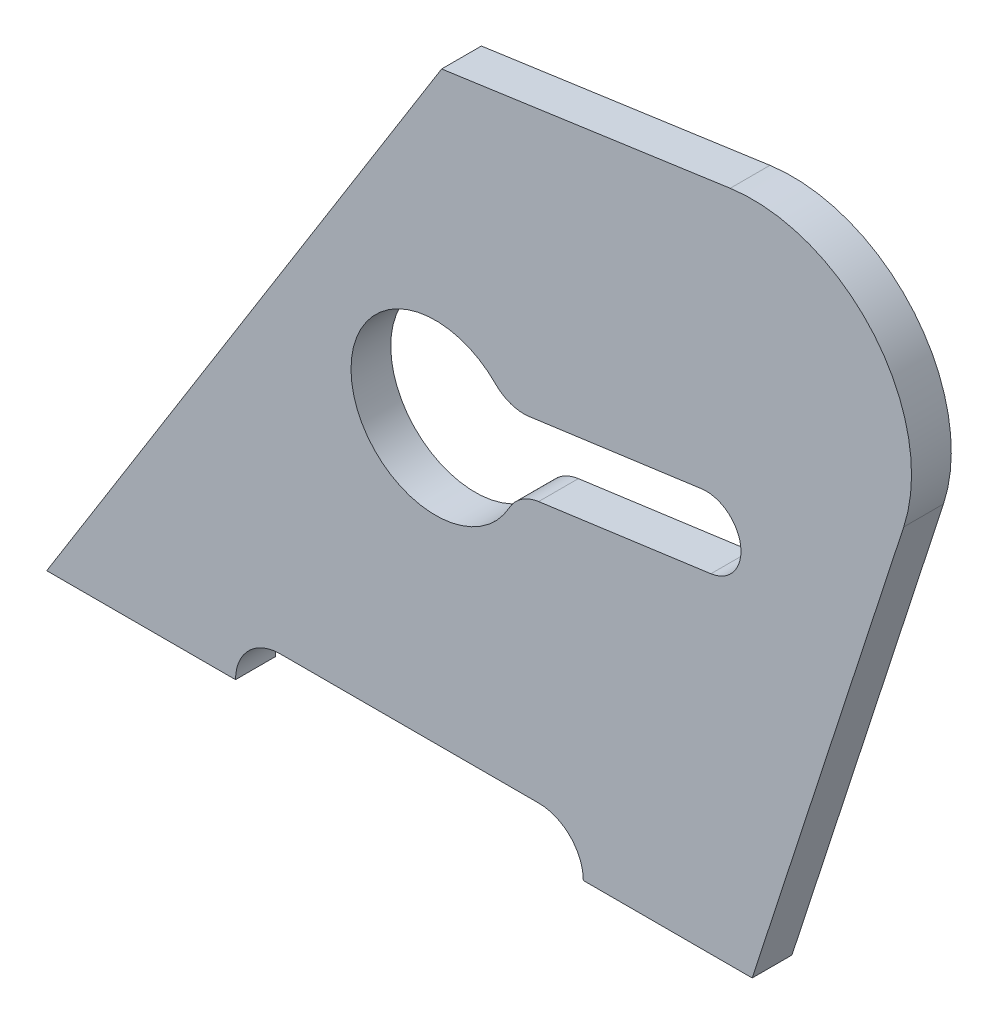
from build123d import *

# Parameters (mm, degrees)
DODANIE_WYCI_GNI_CIE1_DEPTH = 8


with BuildPart() as part:
    # Szkic1 → Dodanie-wyciągnięcie1 (new body)
    with BuildSketch(Plane.XY):
        with BuildLine():
            Line((79.487889635, 127.207214423), (0, 0))
            Line((0, 0), (38, 0))
            ThreePointArc((38, 0), (40.636038969, 6.363961031), (47, 9))
            Line((47, 9), (99, 9))
            ThreePointArc((99, 9), (105.363961031, 6.363961031), (108, 0))
            Line((108, 0), (142, 0))
            Line((142, 0), (172.50354814, 93.880267937))
            ThreePointArc((172.50354814, 93.880267937), (166.569139078, 124.354715336), (137.573015724, 135.451290736))
            Line((137.573015724, 135.451290736), (79.487889635, 127.207214423))
        make_face()
        with BuildLine():
            Line((97.109133521, 75.428206388), (131.785075785, 80.179945877))
            ThreePointArc((131.785075785, 80.179945877), (137.336921521, 78.519813598), (139.735423682, 73.244757424))
            ThreePointArc((139.735423682, 73.244757424), (138.010479856, 68.643259585), (133.68577158, 66.309568971))
            Line((133.68577158, 66.309568971), (99.009829317, 61.557829483))
            ThreePointArc((99.009829317, 61.557829483), (95.579909698, 60.235342824), (93.103530342, 57.518568112))
            ThreePointArc((93.103530342, 57.518568112), (61.402056741, 63.469750476), (90.33394504, 77.729688746))
            ThreePointArc((90.33394504, 77.729688746), (93.449886138, 75.779245046), (97.109133521, 75.428206388))
        make_face(mode=Mode.SUBTRACT)
    extrude(amount=DODANIE_WYCI_GNI_CIE1_DEPTH)


solid = part.part
